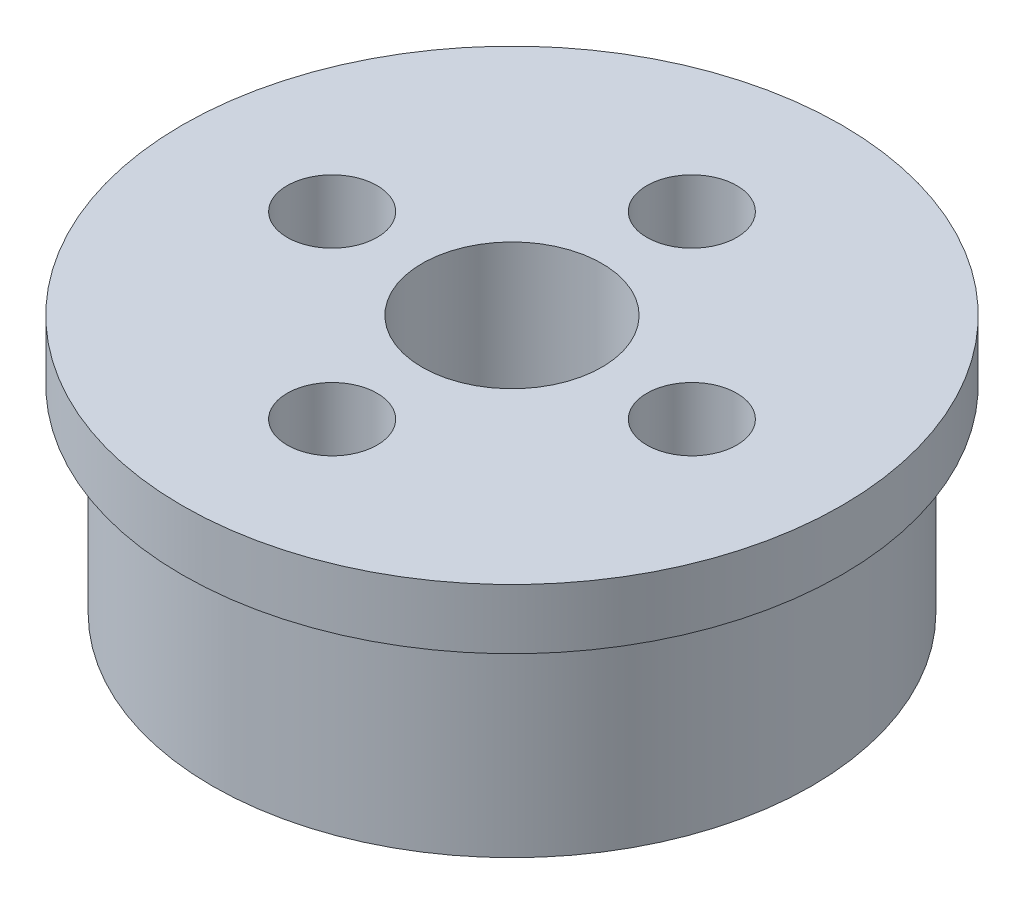
from build123d import *

# Parameters (mm, degrees)
SKETCH_1_R               = 10
SKETCH_1_R_2             = 3
EXTRUDE_1_DEPTH          = 6.6
SKETCH_2_R               = 11
SKETCH_2_R_2             = 3
EXTRUDE_2_DEPTH          = 2
CUT_EXTRUDE_1_REACH      = 19.775
SKETCH_3_R               = 1.5
PATTERN_CIRCULAR_1_COUNT = 4


with BuildPart() as part:
    # 草图1 → 凸台-拉伸1 (new body)
    with BuildSketch(Plane(origin=(0, 0, 0), x_dir=(1, 0, 0), z_dir=(0, 1, 0))):
        with Locations(Location((0, 0, 0), (0, 0, 270))):
            Circle(SKETCH_1_R)
        with Locations(Location((0, 0, 0), (0, 0, 270))):
            Circle(SKETCH_1_R_2, mode=Mode.SUBTRACT)
    extrude(amount=EXTRUDE_1_DEPTH)

    # 草图2 → 凸台-拉伸2 (add)
    with BuildSketch(Plane(origin=(0, 6.6, 0), x_dir=(1, 0, 0), z_dir=(0, 1, 0))):
        with Locations(Location((0, 0, 0), (0, 0, 270))):
            Circle(SKETCH_2_R)
        with Locations(Location((0, 0, 0), (0, 0, 270))):
            Circle(SKETCH_2_R_2, mode=Mode.SUBTRACT)
    extrude(amount=EXTRUDE_2_DEPTH)

    # 草图3 → 切除-拉伸1 (cut, up to next)
    with BuildSketch(Plane.XZ, mode=Mode.PRIVATE) as cut_extrude_1_sk1:
        with Locations(Location((0, 6, 0), (0, 0, 270))):
            Circle(SKETCH_3_R)
    cut_extrude_1_tool1 = extrude(cut_extrude_1_sk1.sketch, amount=-CUT_EXTRUDE_1_REACH, mode=Mode.PRIVATE) & part.part
    cut_extrude_1 = cut_extrude_1_tool1.solids().sort_by_distance((0, 0, 6))[0]
    add(cut_extrude_1, mode=Mode.SUBTRACT)

    # 阵列(圆周)1: 切除-拉伸1 ×4 about axis
    pattern_circular_1_axis = Axis((0, 0, 0), (0, 1, 0))
    for i in range(1, PATTERN_CIRCULAR_1_COUNT):
        add(cut_extrude_1.rotate(pattern_circular_1_axis, i * 360 / PATTERN_CIRCULAR_1_COUNT), mode=Mode.SUBTRACT)


solid = part.part
